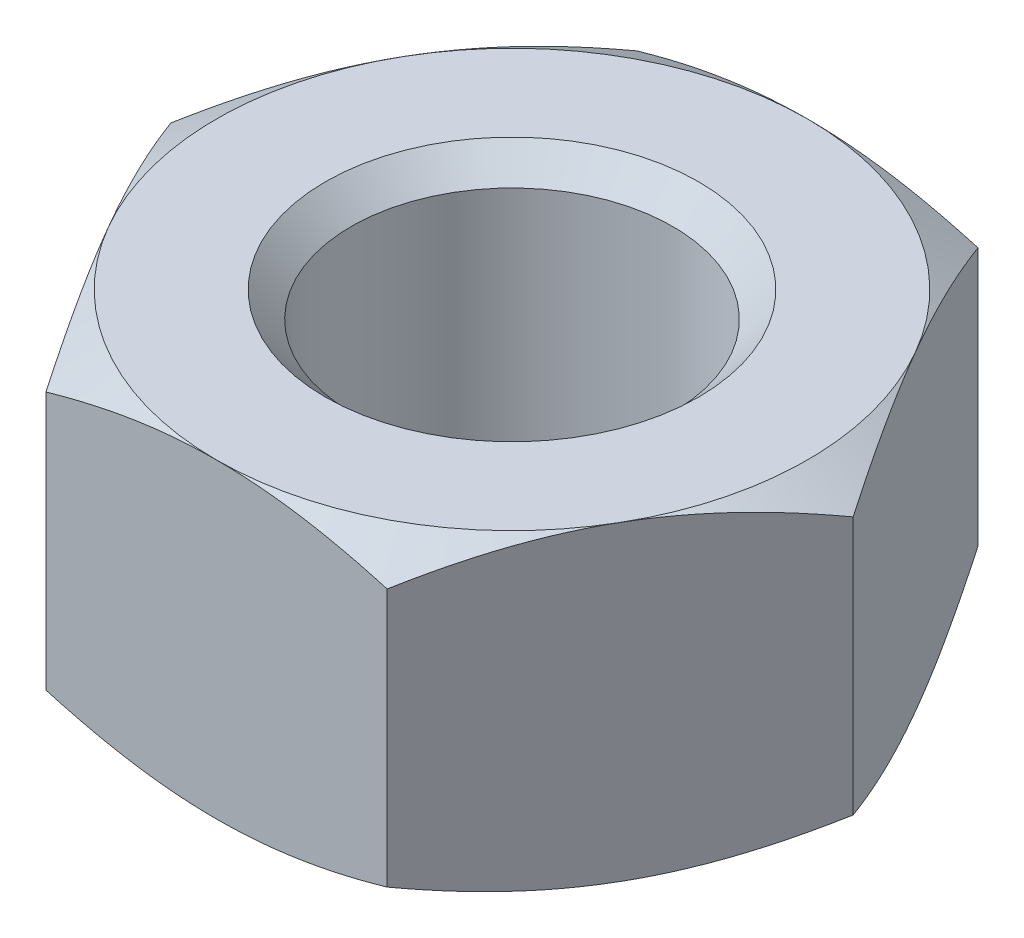
from build123d import *

# Parameters (mm, degrees)
EXTRUDE_1_DEPTH     = 10
SKETCH_4_R          = 5.17
CUT_EXTRUDE_1_DEPTH = 10
CHAMFER_1_SIZE      = 0.83


with BuildPart() as part:
    # Эскиз1 → Бобышка-Вытянуть1 (new body)
    with BuildSketch(Plane(origin=(0, 0, 0), x_dir=(1, 0, 0), z_dir=(0, 1, 0))):
        Polygon((-5.484827557, 9.5), (-10.969655115, 0), (-5.484827557, -9.5), (5.484827557, -9.5), (10.969655115, 0), (5.484827557, 9.5), align=None)
    extrude(amount=EXTRUDE_1_DEPTH)

    # Эскиз2 → Вырез-Повернуть1 (revolve, cut)
    with BuildSketch(Plane(origin=(0, 0, 0), x_dir=(0, 0, -1), z_dir=(1, 0, 0))):
        Polygon((-9.5, 10), (-10.97, 10), (-10.97, 9.151295104), align=None)
        Polygon((-9.5, 0), (-10.97, 0), (-10.97, 0.848704896), align=None)
    revolve(axis=Axis((0, -1000, 0), (0, 1, 0)), mode=Mode.SUBTRACT)

    # Эскиз4 → Вырез-Вытянуть1 (cut)
    with BuildSketch(Plane.XZ):
        with Locations(Location((0, 0, 0), (0, 0, 270))):
            Circle(SKETCH_4_R)
    extrude(amount=-CUT_EXTRUDE_1_DEPTH, mode=Mode.SUBTRACT)

    # Фаска1
    chamfer_1_edges = [part.edges().sort_by_distance(p)[0] for p in [
        (0, 10, 5.17),
        (0, 0, 5.17),
    ]]
    chamfer(chamfer_1_edges, length=CHAMFER_1_SIZE)


solid = part.part
